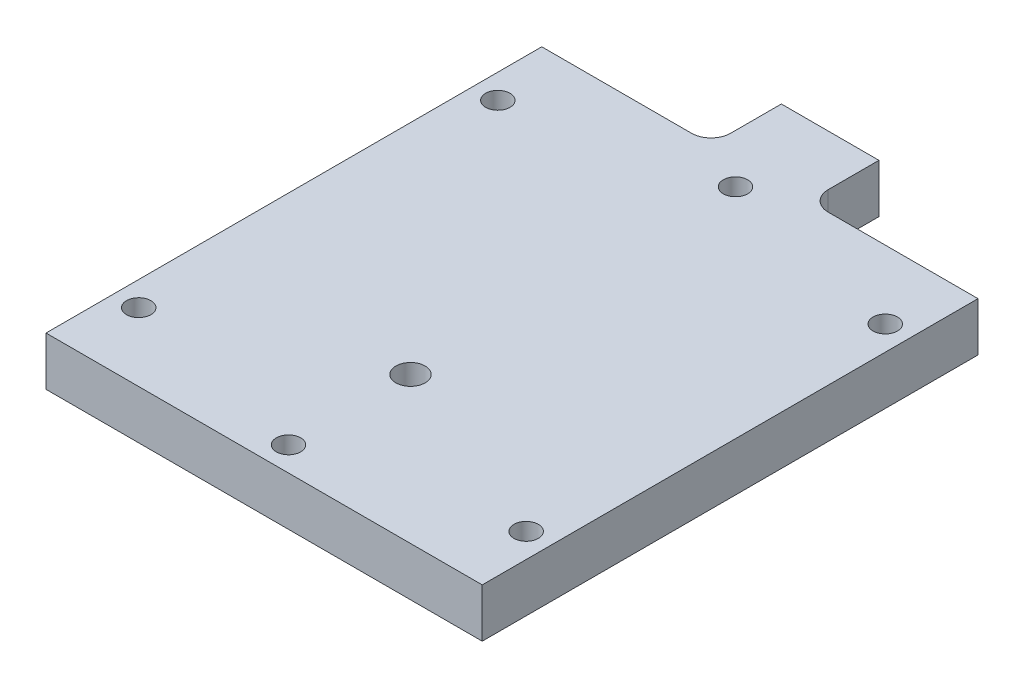
from build123d import *

# Parameters (mm, degrees)
ESQUISSE1_R             = 1.5
EXTRUSION1_DEPTH        = 5
TROU_TARAUD_M3X0_51_D   = 2.5
ESQUISSE6_R             = 2.9
ENL_V_MAT_EXTRU_3_DEPTH = 49.536712909


with BuildPart() as part:
    # Esquisse1 → Extrusion1 (new body)
    with BuildSketch(Plane(origin=(0, 0, 0), x_dir=(1, 0, 0), z_dir=(0, 1, 0))):
        with BuildLine():
            Line((-22.35, 35.8), (-7, 35.8))
            ThreePointArc((-7, 35.8), (-5.585786438, 36.385786438), (-5, 37.8))
            Line((-5, 37.8), (-5, 43))
            Line((-5, 43), (5, 43))
            Line((5, 43), (5, 37.8))
            ThreePointArc((5, 37.8), (5.585786438, 36.385786438), (7, 35.8))
            Line((7, 35.8), (22.35, 35.8))
            Line((22.35, 35.8), (22.35, -15))
            Line((22.35, -15), (-22.35, -15))
            Line((-22.35, -15), (-22.35, 35.8))
        make_face()
        Circle(ESQUISSE1_R, mode=Mode.SUBTRACT)
    extrude(amount=EXTRUSION1_DEPTH)

    # Trou taraudé M3x0.51 (through all)
    with Locations(Plane(origin=(0, 5, 0), x_dir=(-1, 0, 0), z_dir=(0, 1, 0))):
        with Locations((0, -33.3), (-19.85, -28.8), (-19.85, 8), (0, 12.5), (19.85, -28.8), (19.85, 8)):
            Hole(TROU_TARAUD_M3X0_51_D / 2)

    # Esquisse6 → Enlèv. mat.-Extru.3 (cut, through all)
    with BuildSketch(Plane(origin=(0, 2.7, 0), x_dir=(1, 0, 0), z_dir=(0, 1, 0))):
        Circle(ESQUISSE6_R)
    extrude(amount=-ENL_V_MAT_EXTRU_3_DEPTH, mode=Mode.SUBTRACT)


solid = part.part
